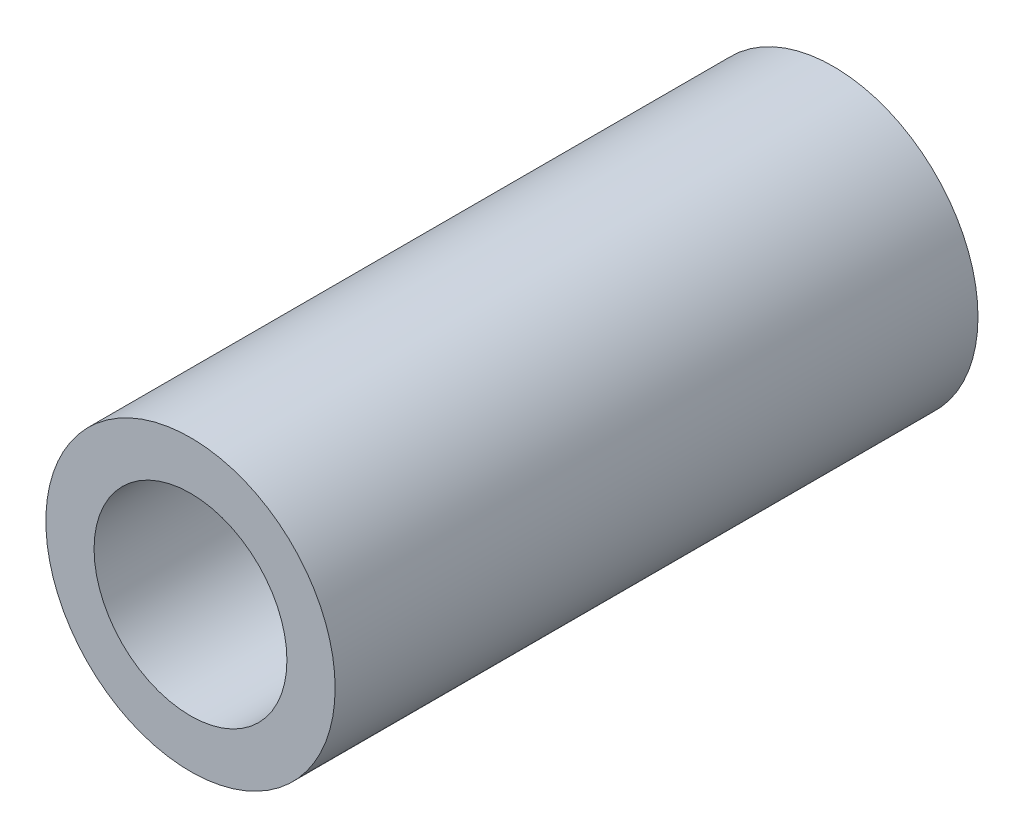
from build123d import *

# Parameters (mm, degrees)
SKETCH1_R           = 2.25
SKETCH1_R_2         = 1.5
BOSS_EXTRUDE1_DEPTH = 10


with BuildPart() as part:
    # Sketch1 → Boss-Extrude1 (new body)
    with BuildSketch(Plane.XY):
        Circle(SKETCH1_R)
        Circle(SKETCH1_R_2, mode=Mode.SUBTRACT)
    extrude(amount=BOSS_EXTRUDE1_DEPTH)


solid = part.part
